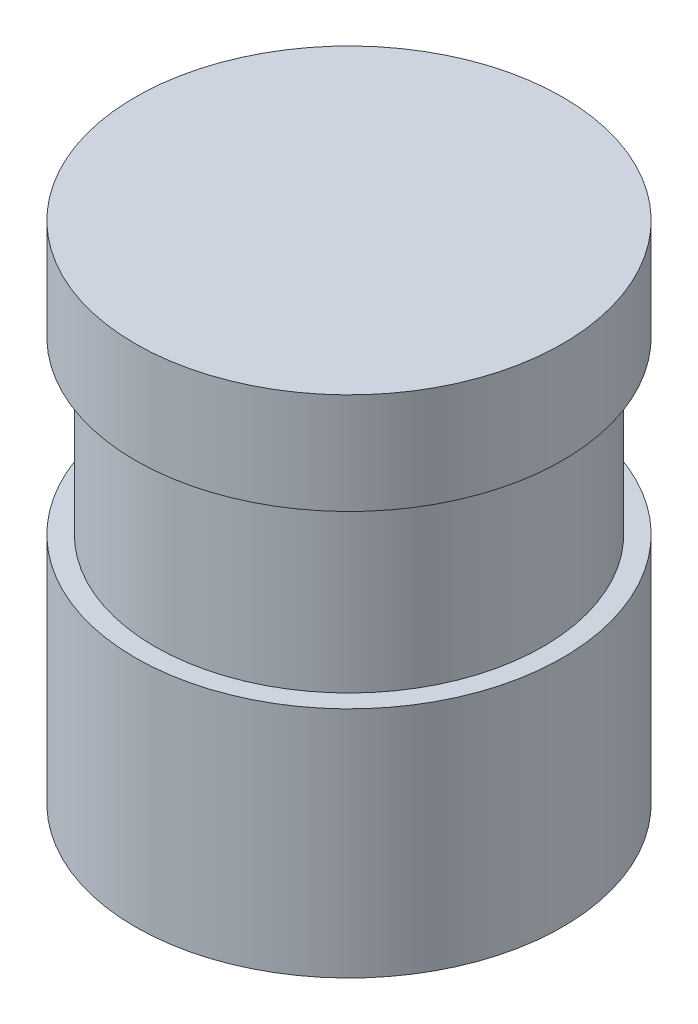
from build123d import *

# Parameters (mm, degrees)
SKETCH_1_R      = 27.5
EXTRUDE_1_DEPTH = 30
SKETCH_2_R      = 25
EXTRUDE_2_DEPTH = 22
SKETCH_3_R      = 27.5
EXTRUDE_3_DEPTH = 13


with BuildPart() as part:
    # Эскиз1 → Бобышка-Вытянуть1 (new body)
    with BuildSketch(Plane(origin=(0, 0, 0), x_dir=(1, 0, 0), z_dir=(0, 1, 0))):
        with Locations(Location((0, 0, 0), (0, 0, 270))):
            Circle(SKETCH_1_R)
    extrude(amount=EXTRUDE_1_DEPTH)

    # Эскиз2 → Бобышка-Вытянуть2 (add)
    with BuildSketch(Plane(origin=(0, 30, 0), x_dir=(1, 0, 0), z_dir=(0, 1, 0))):
        with Locations(Location((0, 0, 0), (0, 0, 270))):
            Circle(SKETCH_2_R)
    extrude(amount=EXTRUDE_2_DEPTH)

    # Эскиз3 → Бобышка-Вытянуть3 (add)
    with BuildSketch(Plane(origin=(0, 52, 0), x_dir=(1, 0, 0), z_dir=(0, 1, 0))):
        with Locations(Location((0, 0, 0), (0, 0, 270))):
            Circle(SKETCH_3_R)
    extrude(amount=EXTRUDE_3_DEPTH)


solid = part.part
